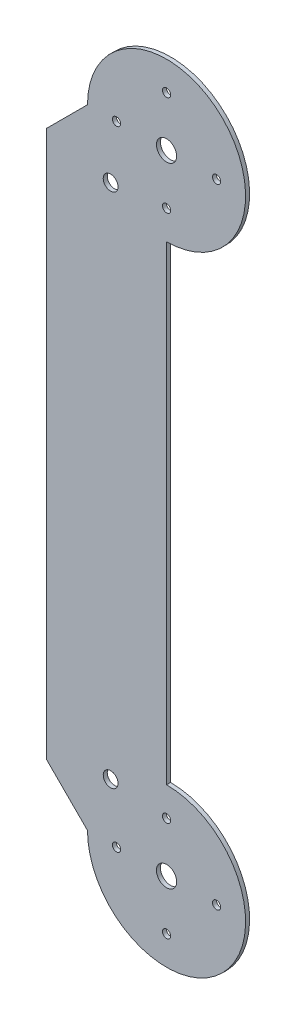
from build123d import *

# Parameters (mm, degrees)
SKETCH_1_R      = 5.05
SKETCH_1_R_2    = 2.05
SKETCH_1_R_3    = 3.701732688
EXTRUDE_1_DEPTH = 2


with BuildPart() as part:
    # 草图1 → 凸台-拉伸1 (new body)
    with BuildSketch(Plane.XY):
        with BuildLine():
            Line((-80.687991051, 42.414942906), (-80.687991051, -192.585057094))
            ThreePointArc((-80.687991051, -192.585057094), (-52.757273194, -260.015774951), (-120.187991051, -232.085057094))
            Line((-120.187991051, -232.085057094), (-140.687991051, -211.585057094))
            Line((-140.687991051, -211.585057094), (-140.687991051, 61.414942906))
            Line((-140.687991051, 61.414942906), (-120.187991051, 81.914942906))
            ThreePointArc((-120.187991051, 81.914942906), (-52.757273194, 109.845660763), (-80.687991051, 42.414942906))
        make_face()
        with Locations((-80.687991051, 81.914942906)):
            Circle(SKETCH_1_R, mode=Mode.SUBTRACT)
        with Locations((-80.687991051, 56.914942906)):
            Circle(SKETCH_1_R_2, mode=Mode.SUBTRACT)
        with Locations((-108.618708908, 53.984225049)):
            Circle(SKETCH_1_R_3, mode=Mode.SUBTRACT)
        with Locations((-55.687991051, 81.914942906)):
            Circle(SKETCH_1_R_2, mode=Mode.SUBTRACT)
        with Locations((-105.687991051, 81.914942906)):
            Circle(SKETCH_1_R_2, mode=Mode.SUBTRACT)
        with Locations((-80.687991051, 106.914942906)):
            Circle(SKETCH_1_R_2, mode=Mode.SUBTRACT)
        with Locations(Location((-80.687991051, -257.085057094, 0), (0, 0, 180))):
            Circle(SKETCH_1_R_2, mode=Mode.SUBTRACT)
        with Locations(Location((-105.687991051, -232.085057094, 0), (0, 0, 180))):
            Circle(SKETCH_1_R_2, mode=Mode.SUBTRACT)
        with Locations(Location((-55.687991051, -232.085057094, 0), (0, 0, 180))):
            Circle(SKETCH_1_R_2, mode=Mode.SUBTRACT)
        with Locations(Location((-108.618708908, -204.154339237, 0), (0, 0, 180))):
            Circle(SKETCH_1_R_3, mode=Mode.SUBTRACT)
        with Locations(Location((-80.687991051, -207.085057094, 0), (0, 0, 180))):
            Circle(SKETCH_1_R_2, mode=Mode.SUBTRACT)
        with Locations(Location((-80.687991051, -232.085057094, 0), (0, 0, 180))):
            Circle(SKETCH_1_R, mode=Mode.SUBTRACT)
    extrude(amount=EXTRUDE_1_DEPTH)


solid = part.part
